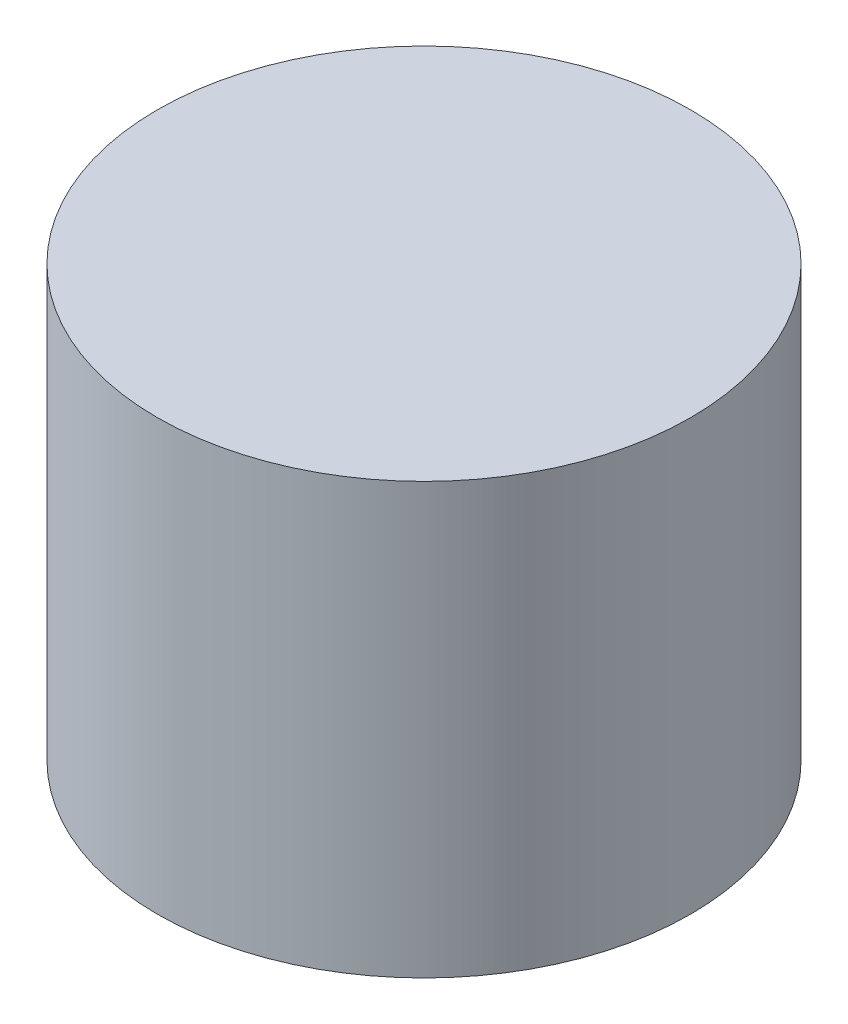
from build123d import *

# Parameters (mm, degrees)
SKETCH_1_R      = 46.5
EXTRUDE_1_DEPTH = 75


with BuildPart() as part:
    # 草图1 → 凸台-拉伸1 (new body)
    with BuildSketch(Plane(origin=(0, 0, 0), x_dir=(1, 0, 0), z_dir=(0, 1, 0))):
        with Locations(Location((0, 0, 0), (0, 0, 270))):
            Circle(SKETCH_1_R)
    extrude(amount=EXTRUDE_1_DEPTH)


solid = part.part
